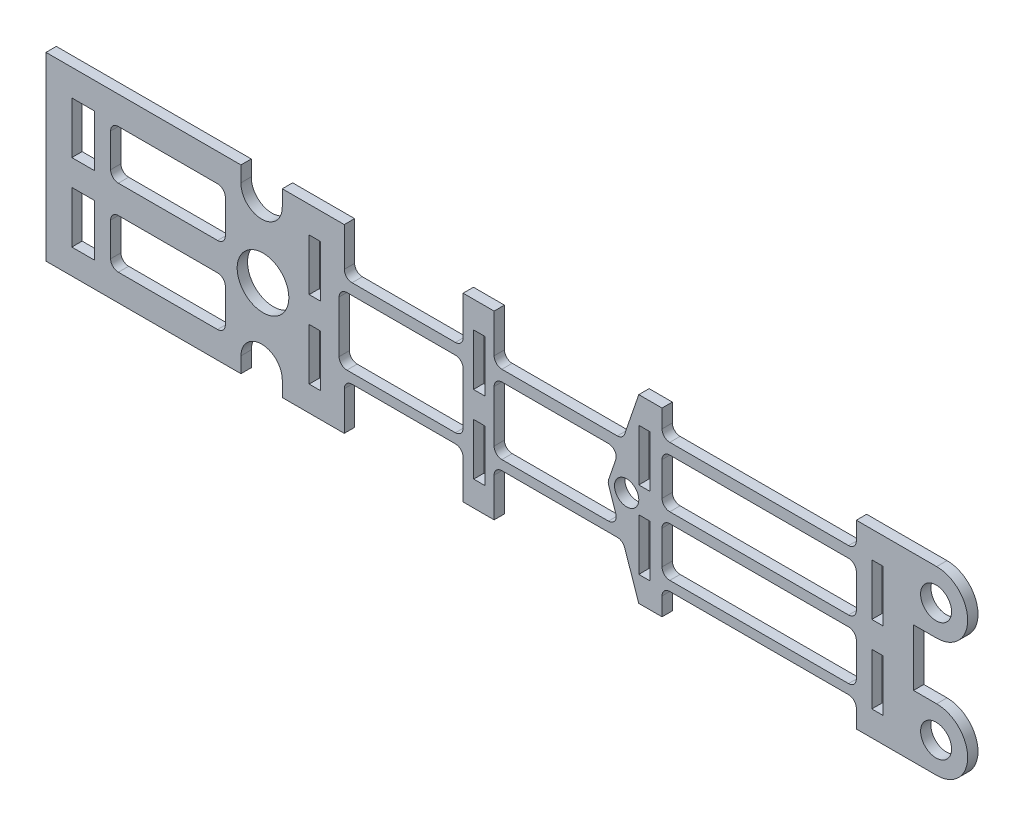
from build123d import *

# Parameters (mm, degrees)
MODEL_R         = 3
MODEL_R_2       = 2.35
MODEL_R_3       = 5
MODEL_W         = 2.2
MODEL_H         = 10
MODEL_W_2       = 4.4
EXTRUDE_1_DEPTH = 2


with BuildPart() as part:
    # Model → 凸台-拉伸1 (new body)
    with BuildSketch(Plane.XY):
        with BuildLine():
            Line((42.75436257, 5.542220319), (42.75436257, 2.542220319))
            Line((42.75436257, 2.542220319), (5.024750427, 2.542220319))
            Line((5.024750427, 2.542220319), (5.024750427, 37.542220319))
            Line((5.024750427, 37.542220319), (42.75436257, 37.542220319))
            Line((42.75436257, 37.542220319), (42.75436257, 34.542220319))
            ThreePointArc((42.75436257, 34.542220319), (46.753332445, 30.45804663), (50.75230232, 34.542220319))
            Line((50.75230232, 34.542220319), (50.75230232, 37.542220319))
            Line((50.75230232, 37.542220319), (62.753332445, 37.542220319))
            Line((62.753332445, 37.542220319), (62.753332445, 30.042220319))
            ThreePointArc((62.753332445, 30.042220319), (63.192672273, 28.981560148), (64.253332445, 28.542220319))
            Line((64.253332445, 28.542220319), (84.253332445, 28.542220319))
            ThreePointArc((84.253332445, 28.542220319), (85.313992617, 28.981560148), (85.753332445, 30.042220319))
            Line((85.753332445, 30.042220319), (85.753332445, 37.542220319))
            Line((85.753332445, 37.542220319), (91.753332445, 37.542220319))
            Line((91.753332445, 37.542220319), (91.753332445, 30.042220319))
            ThreePointArc((91.753332445, 30.042220319), (92.192672273, 28.981560148), (93.253332445, 28.542220319))
            Line((93.253332445, 28.542220319), (115.596034226, 28.542220319))
            ThreePointArc((115.596034226, 28.542220319), (116.467891517, 28.821620113), (117.014953145, 29.555733833))
            Line((117.014953145, 29.555733833), (119.753177083, 37.542220319))
            Line((119.753177083, 37.542220319), (124.252549671, 37.542220319))
            Line((124.252549671, 37.542220319), (124.252549671, 34.042220319))
            ThreePointArc((124.252549671, 34.042220319), (124.6918895, 32.981560148), (125.752549671, 32.542220319))
            Line((125.752549671, 32.542220319), (160.352549671, 32.542220319))
            ThreePointArc((160.352549671, 32.542220319), (161.413209843, 32.981560148), (161.852549671, 34.042220319))
            Line((161.852549671, 34.042220319), (161.852549671, 37.542220319))
            Line((161.852549671, 37.542220319), (177.404402917, 37.542220319))
            ThreePointArc((177.404402917, 37.542220319), (183.404402917, 31.542220319), (177.404402917, 25.542220319))
            Line((177.404402917, 25.542220319), (172.92249216, 25.542220319))
            Line((172.92249216, 25.542220319), (172.92249216, 14.542220319))
            Line((172.92249216, 14.542220319), (177.404402917, 14.542220319))
            ThreePointArc((177.404402917, 14.542220319), (183.404402917, 8.542220319), (177.404402917, 2.542220319))
            Line((177.404402917, 2.542220319), (161.852549671, 2.542220319))
            Line((161.852549671, 2.542220319), (161.852549671, 6.042220319))
            ThreePointArc((161.852549671, 6.042220319), (161.413209843, 7.102880491), (160.352549671, 7.542220319))
            Line((160.352549671, 7.542220319), (125.752549671, 7.542220319))
            ThreePointArc((125.752549671, 7.542220319), (124.6918895, 7.102880491), (124.252549671, 6.042220319))
            Line((124.252549671, 6.042220319), (124.252549671, 2.542220319))
            Line((124.252549671, 2.542220319), (119.753177083, 2.542220319))
            Line((119.753177083, 2.542220319), (117.014953145, 10.528706806))
            ThreePointArc((117.014953145, 10.528706806), (116.467891517, 11.262820526), (115.596034226, 11.542220319))
            Line((115.596034226, 11.542220319), (93.253332445, 11.542220319))
            ThreePointArc((93.253332445, 11.542220319), (92.192672273, 11.102880491), (91.753332445, 10.042220319))
            Line((91.753332445, 10.042220319), (91.753332445, 2.542220319))
            Line((91.753332445, 2.542220319), (85.753332445, 2.542220319))
            Line((85.753332445, 2.542220319), (85.753332445, 10.042220319))
            ThreePointArc((85.753332445, 10.042220319), (85.313992617, 11.102880491), (84.253332445, 11.542220319))
            Line((84.253332445, 11.542220319), (64.253332445, 11.542220319))
            ThreePointArc((64.253332445, 11.542220319), (63.192672273, 11.102880491), (62.753332445, 10.042220319))
            Line((62.753332445, 10.042220319), (62.753332445, 2.542220319))
            Line((62.753332445, 2.542220319), (50.75230232, 2.542220319))
            Line((50.75230232, 2.542220319), (50.753797115, 5.474964717))
            ThreePointArc((50.753797115, 5.474964717), (46.787707643, 9.508309791), (42.75436257, 5.542220319))
        make_face()
        with Locations((177.291852583, 31.405122008)):
            Circle(MODEL_R, mode=Mode.SUBTRACT)
        with Locations((177.291852583, 8.405122008)):
            Circle(MODEL_R, mode=Mode.SUBTRACT)
        with Locations((117.403177083, 19.905122008)):
            Circle(MODEL_R_2, mode=Mode.SUBTRACT)
        with Locations((47.026395841, 19.905122008)):
            Circle(MODEL_R_3, mode=Mode.SUBTRACT)
        with Locations((57.053332445, 27.405122008)):
            Rectangle(MODEL_W, MODEL_H, mode=Mode.SUBTRACT)
        with Locations((57.053332445, 12.405122008)):
            Rectangle(MODEL_W, MODEL_H, mode=Mode.SUBTRACT)
        with Locations((165.952549671, 27.405122008)):
            Rectangle(MODEL_W, MODEL_H, mode=Mode.SUBTRACT)
        with Locations((165.952549671, 12.405122008)):
            Rectangle(MODEL_W, MODEL_H, mode=Mode.SUBTRACT)
        with Locations((120.853177083, 27.405122008)):
            Rectangle(MODEL_W, MODEL_H, mode=Mode.SUBTRACT)
        with Locations((120.853177083, 12.405122008)):
            Rectangle(MODEL_W, MODEL_H, mode=Mode.SUBTRACT)
        Polygon((87.753332445, 32.405122008), (89.953332445, 32.405122008), (89.953318849, 22.40745396), (87.753332445, 22.405122008), align=None, mode=Mode.SUBTRACT)
        Polygon((87.799905777, 7.3998381), (89.999905777, 7.3998381), (89.953262633, 17.3998381), (87.799905777, 17.3998381), align=None, mode=Mode.SUBTRACT)
        with BuildLine():
            Line((63.253332445, 26.405122008), (84.253332445, 26.405122008))
            ThreePointArc((84.253332445, 26.405122008), (85.313992617, 25.96578218), (85.753332445, 24.905122008))
            Line((85.753332445, 24.905122008), (85.753332445, 14.905122008))
            ThreePointArc((85.753332445, 14.905122008), (85.313992617, 13.844461836), (84.253332445, 13.405122008))
            Line((84.253332445, 13.405122008), (63.253332445, 13.405122008))
            ThreePointArc((63.253332445, 13.405122008), (62.192672273, 13.844461836), (61.753332445, 14.905122008))
            Line((61.753332445, 14.905122008), (61.753332445, 24.905122008))
            ThreePointArc((61.753332445, 24.905122008), (62.192672273, 25.96578218), (63.253332445, 26.405122008))
        make_face(mode=Mode.SUBTRACT)
        with BuildLine():
            Line((113.881748512, 13.405122008), (93.253332445, 13.405122008))
            ThreePointArc((93.253332445, 13.405122008), (92.192672273, 13.844461836), (91.753332445, 14.905122008))
            Line((91.753332445, 14.905122008), (91.753332445, 24.905122008))
            ThreePointArc((91.753332445, 24.905122008), (92.192672273, 25.96578218), (93.253332445, 26.405122008))
            Line((93.253332445, 26.405122008), (113.881748512, 26.405122008))
            ThreePointArc((113.881748512, 26.405122008), (115.102348719, 25.776979299), (115.300667431, 24.418635521))
            Line((115.300667431, 24.418635521), (113.91997245, 20.391608494))
            ThreePointArc((113.91997245, 20.391608494), (113.838891369, 19.905122008), (113.91997245, 19.418635521))
            Line((113.91997245, 19.418635521), (115.300667431, 15.391608494))
            ThreePointArc((115.300667431, 15.391608494), (115.102348719, 14.033264717), (113.881748512, 13.405122008))
        make_face(mode=Mode.SUBTRACT)
        with BuildLine():
            Line((161.852549671, 22.405122008), (161.852549671, 28.905122008))
            ThreePointArc((161.852549671, 28.905122008), (161.413209843, 29.96578218), (160.352549671, 30.405122008))
            Line((160.352549671, 30.405122008), (125.752549671, 30.405122008))
            ThreePointArc((125.752549671, 30.405122008), (124.6918895, 29.96578218), (124.252549671, 28.905122008))
            Line((124.252549671, 28.905122008), (124.252549671, 22.405122008))
            ThreePointArc((124.252549671, 22.405122008), (124.6918895, 21.344461836), (125.752549671, 20.905122008))
            Line((125.752549671, 20.905122008), (160.352549671, 20.905122008))
            ThreePointArc((160.352549671, 20.905122008), (161.413209843, 21.344461836), (161.852549671, 22.405122008))
        make_face(mode=Mode.SUBTRACT)
        with BuildLine():
            Line((124.252549671, 17.405122008), (124.252549671, 10.905122008))
            ThreePointArc((124.252549671, 10.905122008), (124.6918895, 9.844461836), (125.752549671, 9.405122008))
            Line((125.752549671, 9.405122008), (160.352549671, 9.405122008))
            ThreePointArc((160.352549671, 9.405122008), (161.413209843, 9.844461836), (161.852549671, 10.905122008))
            Line((161.852549671, 10.905122008), (161.852549671, 17.405122008))
            ThreePointArc((161.852549671, 17.405122008), (161.413209843, 18.46578218), (160.352549671, 18.905122008))
            Line((160.352549671, 18.905122008), (125.752549671, 18.905122008))
            ThreePointArc((125.752549671, 18.905122008), (124.6918895, 18.46578218), (124.252549671, 17.405122008))
        make_face(mode=Mode.SUBTRACT)
        with Locations((12.224750427, 27.405122008)):
            Rectangle(MODEL_W_2, MODEL_H, mode=Mode.SUBTRACT)
        with Locations((12.224750427, 12.405122008)):
            Rectangle(MODEL_W_2, MODEL_H, mode=Mode.SUBTRACT)
        with BuildLine():
            Line((19.024477888, 17.191523075), (38.228465706, 17.191523075))
            ThreePointArc((38.228465706, 17.191523075), (39.289125877, 16.752183247), (39.728465706, 15.691523075))
            Line((39.728465706, 15.691523075), (39.728465706, 9.191523075))
            ThreePointArc((39.728465706, 9.191523075), (39.289125877, 8.130862903), (38.228465706, 7.691523075))
            Line((38.228465706, 7.691523075), (19.024477888, 7.691523075))
            ThreePointArc((19.024477888, 7.691523075), (17.963817716, 8.130862903), (17.524477888, 9.191523075))
            Line((17.524477888, 9.191523075), (17.524477888, 15.691523075))
            ThreePointArc((17.524477888, 15.691523075), (17.963817716, 16.752183247), (19.024477888, 17.191523075))
        make_face(mode=Mode.SUBTRACT)
        with BuildLine():
            Line((19.024477888, 22.618720941), (38.228465706, 22.618720941))
            ThreePointArc((38.228465706, 22.618720941), (39.289125877, 23.058060769), (39.728465706, 24.118720941))
            Line((39.728465706, 24.118720941), (39.728465706, 30.618720941))
            ThreePointArc((39.728465706, 30.618720941), (39.289125877, 31.679381113), (38.228465706, 32.118720941))
            Line((38.228465706, 32.118720941), (19.024477888, 32.118720941))
            ThreePointArc((19.024477888, 32.118720941), (17.963817716, 31.679381113), (17.524477888, 30.618720941))
            Line((17.524477888, 30.618720941), (17.524477888, 24.118720941))
            ThreePointArc((17.524477888, 24.118720941), (17.963817716, 23.058060769), (19.024477888, 22.618720941))
        make_face(mode=Mode.SUBTRACT)
    extrude(amount=EXTRUDE_1_DEPTH)


solid = part.part
